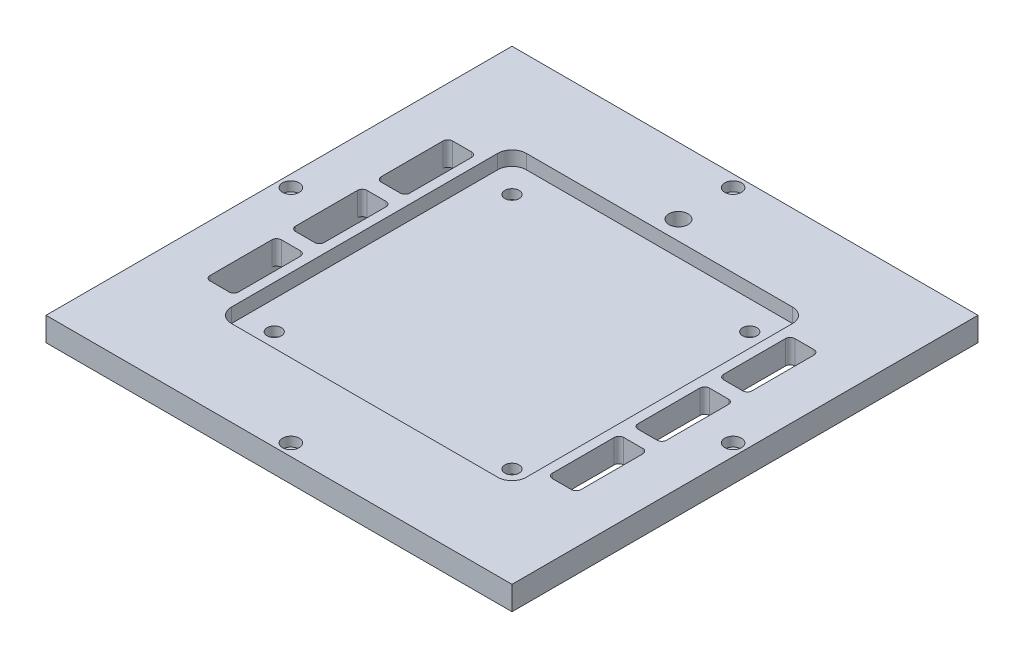
from build123d import *

# Parameters (mm, degrees)
SKETCH1_W           = 98
SKETCH1_H           = 98
BOSS_EXTRUDE2_DEPTH = 5
SKETCH12_W          = 88
SKETCH12_H          = 88
SKETCH12_W_2        = 78
SKETCH12_H_2        = 78
BOSS_EXTRUDE4_DEPTH = 2
SKETCH13_R          = 1.75
CUT_EXTRUDE13_DEPTH = 2
SKETCH14_R          = 1
CUT_EXTRUDE14_DEPTH = 9
SKETCH16_W          = 62
SKETCH16_H          = 62
CUT_EXTRUDE15_DEPTH = 3
FILLET1_R           = 3
SKETCH17_R          = 1.5
CUT_EXTRUDE16_DEPTH = 3
SKETCH23_W          = 6
SKETCH23_H          = 15
CUT_EXTRUDE19_DEPTH = 12
FILLET2_R           = 1
SKETCH24_R          = 2
CUT_EXTRUDE22_DEPTH = 12


with BuildPart() as part:
    # Sketch1 → Boss-Extrude2 (new body)
    with BuildSketch(Plane(origin=(0, 0, 0), x_dir=(1, 0, 0), z_dir=(0, 1, 0))):
        Rectangle(SKETCH1_W, SKETCH1_H)
    extrude(amount=BOSS_EXTRUDE2_DEPTH)

    # Sketch12 → Boss-Extrude4 (add)
    with BuildSketch(Plane.XZ):
        Rectangle(SKETCH12_W, SKETCH12_H)
        Rectangle(SKETCH12_W_2, SKETCH12_H_2, mode=Mode.SUBTRACT)
    extrude(amount=BOSS_EXTRUDE4_DEPTH)

    # Sketch13 → Cut-Extrude13 (cut)
    with BuildSketch(Plane(origin=(0, 5, 0), x_dir=(1, 0, 0), z_dir=(0, 1, 0))):
        with BuildLine():
            ThreePointArc((0, -44.75), (-1.75, -46.5), (0, -48.25))
            Line((0, -48.25), (0, -44.75))
        make_face()
        with BuildLine():
            Line((0, -44.75), (0, -48.25))
            ThreePointArc((0, -48.25), (1.237436867, -47.737436867), (1.75, -46.5))
            ThreePointArc((1.75, -46.5), (1.237436867, -45.262563133), (0, -44.75))
        make_face()
        with Locations(Location((-46.5, 0, 0), (0, 0, 270))):
            Circle(SKETCH13_R)
        with Locations(Location((0, 46.5, 0), (0, 0, 270))):
            Circle(SKETCH13_R)
        with BuildLine():
            ThreePointArc((44.75, 0), (46.5, -1.75), (48.25, 0))
            Line((48.25, 0), (44.75, 0))
        make_face()
        with BuildLine():
            Line((44.75, 0), (48.25, 0))
            ThreePointArc((48.25, 0), (46.5, 1.75), (44.75, 0))
        make_face()
    extrude(amount=-CUT_EXTRUDE13_DEPTH, mode=Mode.SUBTRACT)

    # Sketch14 → Cut-Extrude14 (cut)
    with BuildSketch(Plane(origin=(0, 5, 0), x_dir=(1, 0, 0), z_dir=(0, 1, 0))):
        with Locations(Location((0, -46.5, 0), (0, 0, 270))):
            Circle(SKETCH14_R)
        with Locations(Location((-46.5, 0, 0), (0, 0, 270))):
            Circle(SKETCH14_R)
        with Locations(Location((46.5, 0, 0), (0, 0, 270))):
            Circle(SKETCH14_R)
        with Locations(Location((0, 46.5, 0), (0, 0, 270))):
            Circle(SKETCH14_R)
    extrude(amount=-CUT_EXTRUDE14_DEPTH, mode=Mode.SUBTRACT)

    # Sketch16 → Cut-Extrude15 (cut)
    with BuildSketch(Plane(origin=(0, 5, 0), x_dir=(1, 0, 0), z_dir=(0, 1, 0))):
        Rectangle(SKETCH16_W, SKETCH16_H)
    extrude(amount=-CUT_EXTRUDE15_DEPTH, mode=Mode.SUBTRACT)

    # Fillet1
    fillet1_edges = [part.edges().sort_by_distance(p)[0] for p in [
        (31, 3.5, -31),
        (31, 3.5, 31),
        (-31, 3.5, 31),
        (-31, 3.5, -31),
    ]]
    fillet(fillet1_edges, radius=FILLET1_R)

    # Sketch17 → Cut-Extrude16 (cut)
    with BuildSketch(Plane(origin=(0, 2, 0), x_dir=(1, 0, 0), z_dir=(0, 1, 0))):
        with Locations(Location((25, 25, 0), (0, 0, 270))):
            Circle(SKETCH17_R)
        with Locations(Location((25, -25, 0), (0, 0, 270))):
            Circle(SKETCH17_R)
        with Locations(Location((-25, 25, 0), (0, 0, 270))):
            Circle(SKETCH17_R)
        with Locations(Location((-25, -25, 0), (0, 0, 270))):
            Circle(SKETCH17_R)
    extrude(amount=-CUT_EXTRUDE16_DEPTH, mode=Mode.SUBTRACT)

    # Sketch23 → Cut-Extrude19 (cut)
    with BuildSketch(Plane(origin=(0, 5, 0), x_dir=(1, 0, 0), z_dir=(0, 1, 0))):
        with Locations((36, 18)):
            Rectangle(SKETCH23_W, SKETCH23_H)
        with Locations((36, 0)):
            Rectangle(SKETCH23_W, SKETCH23_H)
        with Locations((36, -18)):
            Rectangle(SKETCH23_W, SKETCH23_H)
        with Locations((-36, 18)):
            Rectangle(SKETCH23_W, SKETCH23_H)
        with Locations((-36, 0)):
            Rectangle(SKETCH23_W, SKETCH23_H)
        with Locations((-36, -18)):
            Rectangle(SKETCH23_W, SKETCH23_H)
    extrude(amount=-CUT_EXTRUDE19_DEPTH, mode=Mode.SUBTRACT)

    # Fillet2
    fillet2_edges = [part.edges().sort_by_distance(p)[0] for p in [
        (39, 2.5, 7.5),
        (33, 2.5, 7.5),
        (33, 2.5, -7.5),
        (39, 2.5, -7.5),
        (39, 2.5, 10.5),
        (39, 2.5, 25.5),
        (33, 2.5, 25.5),
        (33, 2.5, 10.5),
        (-33, 2.5, -25.5),
        (-33, 2.5, -10.5),
        (-39, 2.5, -10.5),
        (-39, 2.5, -25.5),
        (-33, 2.5, -7.5),
        (-33, 2.5, 7.5),
        (-39, 2.5, 7.5),
        (-39, 2.5, -7.5),
        (-39, 2.5, 10.5),
        (-33, 2.5, 10.5),
        (-33, 2.5, 25.5),
        (-39, 2.5, 25.5),
        (39, 2.5, -25.5),
        (39, 2.5, -10.5),
        (33, 2.5, -10.5),
        (33, 2.5, -25.5),
    ]]
    fillet(fillet2_edges, radius=FILLET2_R)

    # Sketch24 → Cut-Extrude22 (cut)
    with BuildSketch(Plane(origin=(0, 5, 0), x_dir=(1, 0, 0), z_dir=(0, 1, 0))):
        with Locations(Location((0, 35, 0), (0, 0, 270))):
            Circle(SKETCH24_R)
    extrude(amount=-CUT_EXTRUDE22_DEPTH, mode=Mode.SUBTRACT)


solid = part.part
